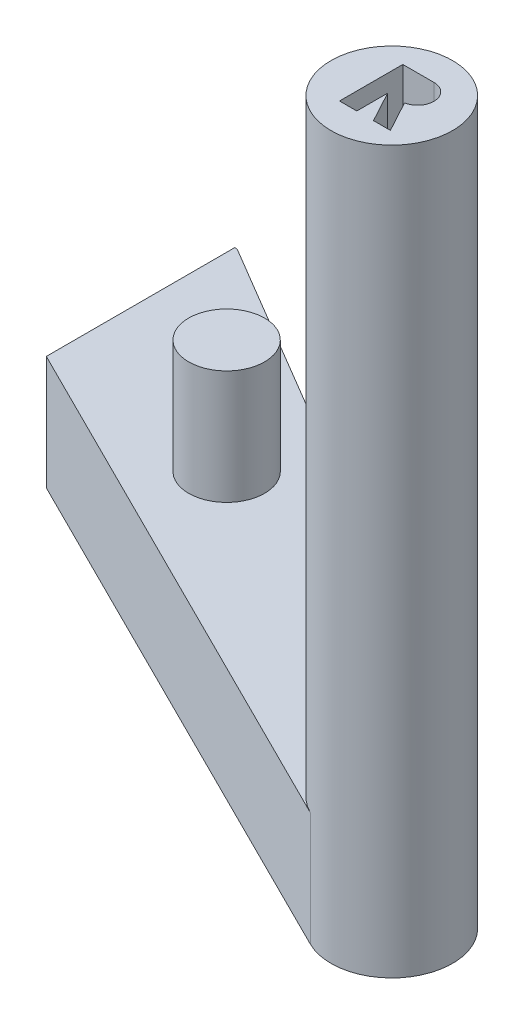
from build123d import *

# Parameters (mm, degrees)
SKETCH1_R           = 8
BOSS_EXTRUDE1_DEPTH = 95
SKETCH2_R           = 4
CUT_EXTRUDE1_DEPTH  = 45
SKETCH4_W           = 2.279315198
SKETCH4_H           = 4.278597429
SKETCH4_H_2         = 4.06286311
CUT_EXTRUDE2_DEPTH  = 40
BOSS_EXTRUDE2_DEPTH = 15
SKETCH6_R           = 5
BOSS_EXTRUDE3_DEPTH = 15


with BuildPart() as part:
    # Sketch1 → Boss-Extrude1 (new body)
    with BuildSketch(Plane(origin=(0, 0, 0), x_dir=(1, 0, 0), z_dir=(0, 1, 0))):
        with Locations(Location((0, 0, 0), (0, 0, 270))):
            Circle(SKETCH1_R)
    extrude(amount=BOSS_EXTRUDE1_DEPTH)

    # Sketch2 → Cut-Extrude1 (cut)
    with BuildSketch(Plane.XZ):
        with Locations(Location((0, 0, 0), (0, 0, 270))):
            Circle(SKETCH2_R)
    extrude(amount=-CUT_EXTRUDE1_DEPTH, mode=Mode.SUBTRACT)

    # Sketch4 → Cut-Extrude2 (cut)
    with BuildSketch(Plane(origin=(0, 95, 0), x_dir=(1, 0, 0), z_dir=(0, 1, 0))):
        with BuildLine():
            Line((1.275256108, 4.278597429), (-0.547648504, 4.278597429))
            Line((-0.547648504, 4.278597429), (-0.547648504, 0))
            Line((-0.547648504, 0), (1.67579289, 0))
            ThreePointArc((1.67579289, 0), (3.423908341, 2.321694794), (1.275256108, 4.278597429))
        make_face()
        with Locations((-1.687306103, 2.139298715)):
            Rectangle(SKETCH4_W, SKETCH4_H)
        with Locations((-1.687306103, -2.031431555)):
            Rectangle(SKETCH4_W, SKETCH4_H_2)
        Polygon((1.67579289, 0), (-0.547648504, 0), (1.653720681, -4.06286311), (3.877162075, -4.06286311), align=None)
    extrude(amount=-CUT_EXTRUDE2_DEPTH, mode=Mode.SUBTRACT)

    # Sketch5 → Boss-Extrude2 (add)
    with BuildSketch(Plane(origin=(0, 0, 0), x_dir=(1, 0, 0), z_dir=(0, 1, 0))):
        with BuildLine():
            ThreePointArc((-62.501736138, 39.996744571), (-65.482019756, 31.895818698), (-73.001736138, 27.657781892))
            Line((-73.001736138, 27.657781892), (-73.001736138, 27.496744571))
            Line((-73.001736138, 27.496744571), (-3.57279106, -7.157874268))
            ThreePointArc((-3.57279106, -7.157874268), (-7.025809748, 3.825963588), (4.074261757, 6.884794197))
            Line((4.074261757, 6.884794197), (-65.396568509, 47.996166726))
            ThreePointArc((-65.396568509, 47.996166726), (-63.247702886, 44.250296301), (-62.501736138, 39.996744571))
        make_face()
        with BuildLine():
            ThreePointArc((-72.612195867, 52.266222852), (-72.806691043, 52.302506515), (-73.001736138, 52.33570725))
            Line((-73.001736138, 52.33570725), (-73.001736138, 27.657781892))
            ThreePointArc((-73.001736138, 27.657781892), (-65.482019756, 31.895818698), (-62.501736138, 39.996744571))
            ThreePointArc((-62.501736138, 39.996744571), (-63.247702886, 44.250296301), (-65.396568509, 47.996166726))
            Line((-65.396568509, 47.996166726), (-72.612195867, 52.266222852))
        make_face()
    extrude(amount=BOSS_EXTRUDE2_DEPTH)

    # Sketch6 → Boss-Extrude3 (add)
    with BuildSketch(Plane(origin=(0, 15, 0), x_dir=(1, 0, 0), z_dir=(0, 1, 0))):
        with Locations(Location((-48.001736138, 26.246610631, 0), (0, 0, 270))):
            Circle(SKETCH6_R)
    extrude(amount=BOSS_EXTRUDE3_DEPTH)

    # Sketch8 → Cut-Revolve1 (revolve, cut)
    with BuildSketch(Plane(origin=(0, 0, 0), x_dir=(-0.4149509310359906, 0, 0.909843791445743), z_dir=(0.909843791445743, 0, 0.4149509310359906)), mode=Mode.PRIVATE) as cut_revolve1_sk:
        Polygon((0, -45), (-4.166361625, -45), (0, -52.216350017), align=None)
    revolve(cut_revolve1_sk.sketch.rotate(Axis((0, 52.216350017, 0), (0, -1, 0)), 6.099837448), axis=Axis((0, 52.216350017, 0), (0, -1, 0)), mode=Mode.SUBTRACT)


solid = part.part
